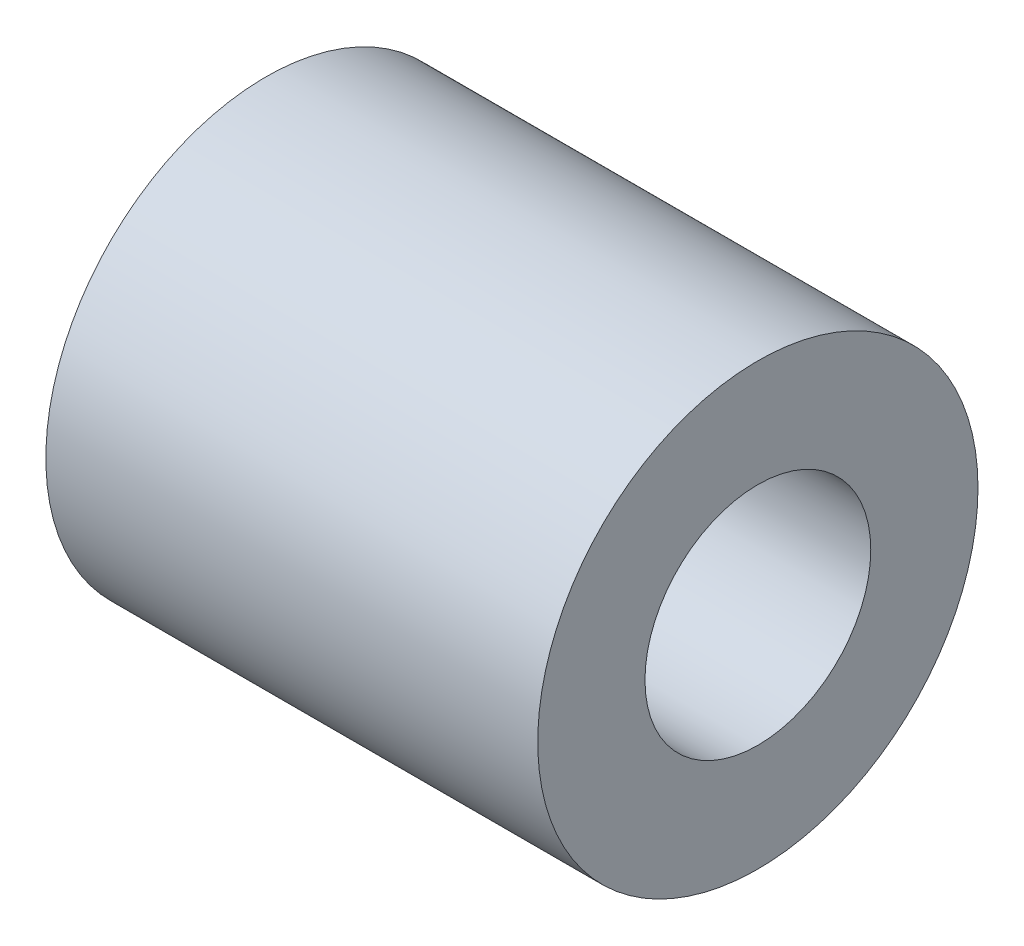
from build123d import *

# Parameters (mm, degrees)
SCHIZZO2_R                   = 3.88
SCHIZZO2_R_2                 = 1.99
ESTRUSIONE_ESTRUSIONE1_DEPTH = 4.335


with BuildPart() as part:
    # Schizzo2 → Estrusione-Estrusione1 (new, symmetric)
    with BuildSketch(Plane(origin=(0, 0, 0), x_dir=(0, 0, -1), z_dir=(1, 0, 0))):
        Circle(SCHIZZO2_R)
        Circle(SCHIZZO2_R_2, mode=Mode.SUBTRACT)
    extrude(amount=ESTRUSIONE_ESTRUSIONE1_DEPTH, both=True)


solid = part.part
